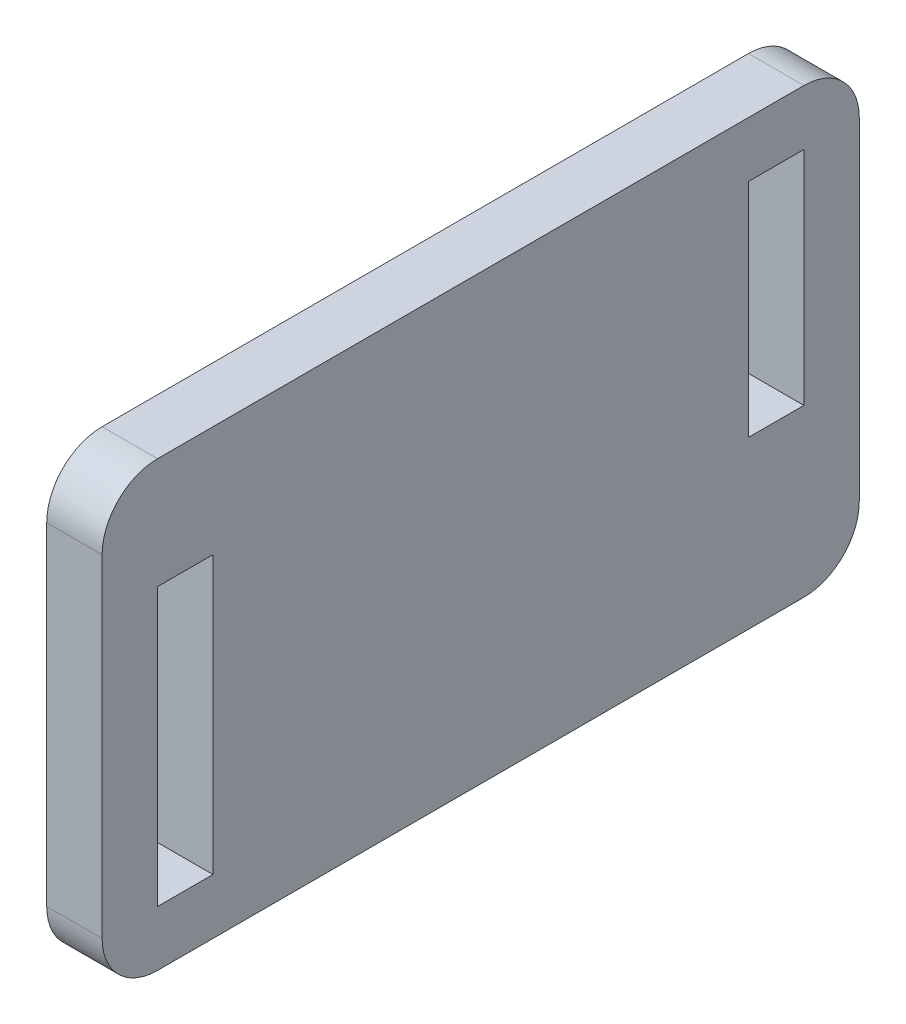
from build123d import *

# Parameters (mm, degrees)
SKETCH_2_W      = 3
SKETCH_2_H      = 15
SKETCH_2_H_2    = 12
EXTRUDE_1_DEPTH = 3
FILLET_1_R      = 3


with BuildPart() as part:
    # Эскиз2 → Бобышка-Вытянуть1 (new body)
    with BuildSketch(Plane(origin=(0, 0, 0), x_dir=(0, 0, -1), z_dir=(1, 0, 0))):
        Polygon((-20.5, -9), (-20.5, 12), (20.5, 12), (20.5, -12), (-20.5, -12), align=None)
        with Locations((-16, -1.5)):
            Rectangle(SKETCH_2_W, SKETCH_2_H, mode=Mode.SUBTRACT)
        with Locations((16, 3)):
            Rectangle(SKETCH_2_W, SKETCH_2_H_2, mode=Mode.SUBTRACT)
    extrude(amount=EXTRUDE_1_DEPTH)

    # Скругление1
    fillet_1_edges = [part.edges().sort_by_distance(p)[0] for p in [
        (1.5, -12, -20.5),
        (1.5, -12, 20.5),
        (1.5, 12, 20.5),
        (1.5, 12, -20.5),
    ]]
    fillet(fillet_1_edges, radius=FILLET_1_R)


solid = part.part
